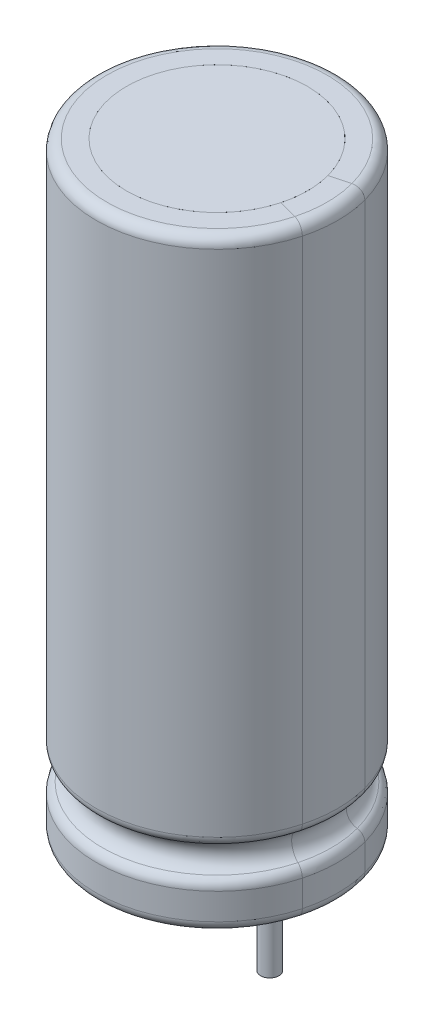
from build123d import *

# Parameters (mm, degrees)
SALIENTE_EXTRUIR3_DEPTH   = 20
SALIENTE_EXTRUIR4_DEPTH   = 20
SALIENTE_EXTRUIR5_DEPTH   = 20
CROQUIS3_R                = 0.4999999999999999
REDONDEO1_R               = 0.35
REDONDEO2_R               = 0.35
CROQUIS4_R                = 0.30107653954551516
SALIENTE_EXTRUIR6_DEPTH   = 3
CROQUIS4_R_2              = 0.30302467240714076
SALIENTE_EXTRUIR6_2_DEPTH = 3


with BuildPart() as part:
    # Croquis1 → Saliente-Extruir3 (new body)
    with BuildSketch(Plane(origin=(0, 0, 0), x_dir=(1, 0, 0), z_dir=(0, 1, 0))):
        with BuildLine():
            Line((3.8637033051562724, 1.0352761804100858), (2.8977774788672046, 0.7764571353075645))
            ThreePointArc((2.897777478867204, 0.7764571353075644), (2.974334584121431, 0.3915785766601559), (3, 0))
            ThreePointArc((3, -7.3e-16), (2.974334584121431, -0.3915785766601577), (2.897777478867204, -0.7764571353075647))
            Line((2.8977774788672046, -0.7764571353075641), (3.8637033051562724, -1.0352761804100854))
            ThreePointArc((3.8637033051562724, -1.0352761804100863), (3.965779445495241, -0.5221047688802103), (4, -9.8e-16))
            ThreePointArc((4, 0), (3.9657794454952415, 0.5221047688802078), (3.8637033051562724, 1.0352761804100858))
        make_face()
    extrude(amount=SALIENTE_EXTRUIR3_DEPTH)


with BuildPart() as body_2:
    # Croquis1<5> → Saliente-Extruir4 (new body)
    with BuildSketch(Plane(origin=(0, 0, 0), x_dir=(1, 0, 0), z_dir=(0, 1, 0))):
        with BuildLine():
            ThreePointArc((3, 0), (2.974334584121431, 0.3915785766601559), (2.897777478867204, 0.7764571353075644))
            ThreePointArc((2.897777478867204, 0.7764571353075644), (-3, -9.6e-16), (2.897777478867205, -0.776457135307562))
            ThreePointArc((2.897777478867204, -0.7764571353075647), (2.974334584121431, -0.3915785766601577), (3, -7.3e-16))
        make_face()
    extrude(amount=SALIENTE_EXTRUIR4_DEPTH)


with BuildPart() as body_3:
    # Croquis1<6> → Saliente-Extruir5 (new body)
    with BuildSketch(Plane(origin=(0, 0, 0), x_dir=(1, 0, 0), z_dir=(0, 1, 0))):
        with BuildLine():
            ThreePointArc((2.897777478867205, -0.776457135307562), (-3, -9.6e-16), (2.897777478867204, 0.7764571353075644))
            Line((2.8977774788672046, 0.7764571353075645), (3.8637033051562724, 1.0352761804100858))
            ThreePointArc((3.8637033051562724, 1.0352761804100858), (-4, 4.9e-16), (3.8637033051562724, -1.0352761804100863))
            Line((3.8637033051562724, -1.0352761804100854), (2.8977774788672046, -0.7764571353075641))
        make_face()
    extrude(amount=SALIENTE_EXTRUIR5_DEPTH)


with BuildPart() as cortar_revoluci_n1_tool:
    # Croquis3 → Cortar-Revolución1 (revolve)
    with BuildSketch(Plane(origin=(0, 0, 0), x_dir=(0, 0, -1), z_dir=(1, 0, 0))):
        with Locations((-4, 1.9999999999999982)):
            Circle(CROQUIS3_R)
    revolve(axis=Axis((0, -1.7359986127882774, 0), (0, 1, 0)))


with BuildPart() as part_1:
    add(part.part)

    # Cortar-Revolución1: cut by cortar_revoluci_n1_tool
    add(cortar_revoluci_n1_tool.part, mode=Mode.SUBTRACT)

    # Redondeo2
    redondeo2_edges = [part_1.edges().sort_by_distance(p)[0] for p in [
        (4, 0, -4.7e-16),
        (3.999999999997482, 1.4999999999999982, -7.0699e-12),
        (3.999999999997482, 2.4999999999999982, 7.09233e-12),
        (4.000000000000001, 20, 6.7e-16),
    ]]
    fillet(redondeo2_edges, radius=REDONDEO2_R)


with BuildPart() as body_3_1:
    add(body_3.part)

    # Cortar-Revolución1: cut by cortar_revoluci_n1_tool
    add(cortar_revoluci_n1_tool.part, mode=Mode.SUBTRACT)

    # Redondeo1
    redondeo1_edges = [body_3_1.edges().sort_by_distance(p)[0] for p in [
        (-4, 0, 6.55e-15),
        (-3.1734133611649407, 1.4999999999999982, -2.435045716034882),
        (-3.1734133611649407, 2.4999999999999982, -2.435045716034882),
        (-4, 20, 6.55e-15),
    ]]
    fillet(redondeo1_edges, radius=REDONDEO1_R)


with BuildPart() as body_4:
    # Croquis4 → Saliente-Extruir6 (new body)
    with BuildSketch(Plane.XZ):
        with Locations((-1.75, 0)):
            Circle(CROQUIS4_R)
    extrude(amount=SALIENTE_EXTRUIR6_DEPTH)


with BuildPart() as body_5:
    # Croquis4 → Saliente-Extruir6 2 (new body)
    with BuildSketch(Plane.XZ):
        with Locations((1.75, 0)):
            Circle(CROQUIS4_R_2)
    extrude(amount=SALIENTE_EXTRUIR6_2_DEPTH)


solid = Compound([body_2.part, part_1.part, body_3_1.part, body_4.part, body_5.part])
